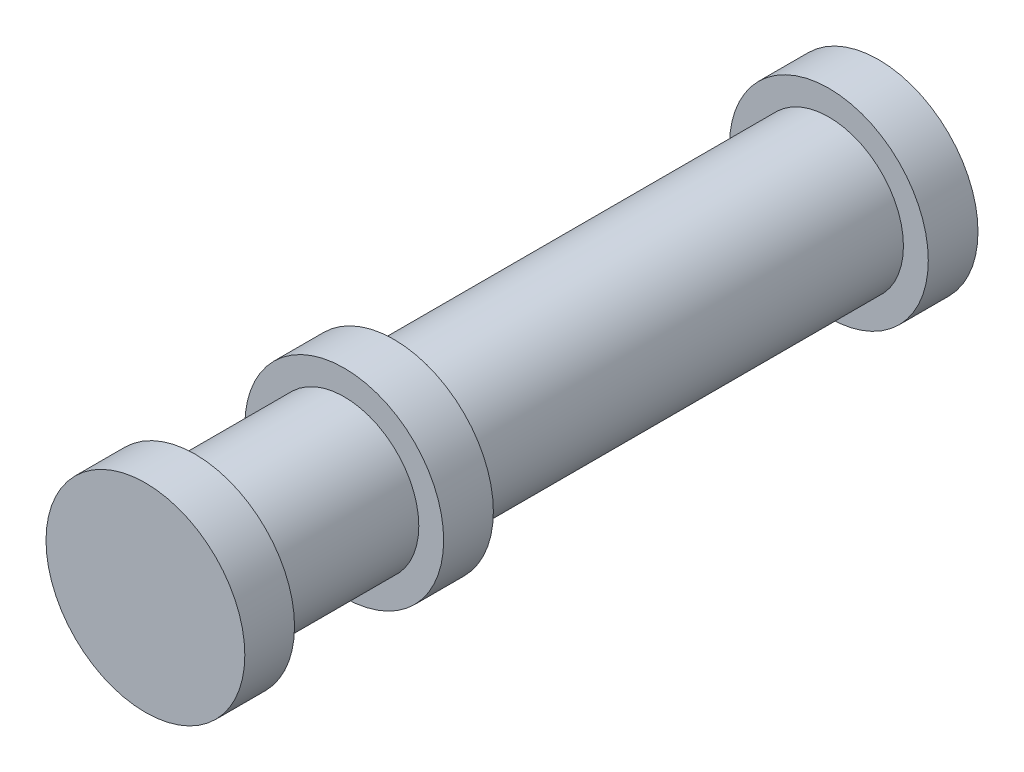
from build123d import *

# Parameters (mm, degrees)
SKETCH_1_R          = 3
EXTRUDE_1_DEPTH     = 17.5
SKETCH_2_R          = 4
EXTRUDE_2_DEPTH     = 2
EXTRUDE_START       = 2
SKETCH_3_R          = 4
EXTRUDE_3_DEPTH     = 2
SKETCH_4_R          = 3
EXTRUDE_4_DEPTH     = 20
SKETCH_5_R          = 4
EXTRUDE_5_DEPTH     = 2
SKETCH_7_R          = 4
CUT_EXTRUDE_1_DEPTH = 16
SKETCH_8_R          = 4
EXTRUDE_6_DEPTH     = 2


with BuildPart() as part:
    # 草图1 → 凸台-拉伸1 (new body)
    with BuildSketch(Plane.XY):
        Circle(SKETCH_1_R)
    extrude(amount=EXTRUDE_1_DEPTH)

    # 草图2 → 凸台-拉伸2 (add)
    with BuildSketch(Plane(origin=(0, 0, 0), x_dir=(-1, 0, 0), z_dir=(0, 0, -1))):
        Circle(SKETCH_2_R)
    extrude(amount=EXTRUDE_2_DEPTH)

    # 草图3 → 凸台-拉伸3 (add)
    with BuildSketch(Plane.XY.offset(17.5).offset(EXTRUDE_START)):
        with Locations(Location((0, 0, 0), (0, 0, 180))):
            Circle(SKETCH_3_R)
    extrude(amount=-EXTRUDE_3_DEPTH)

    # 草图4 → 凸台-拉伸4 (add)
    with BuildSketch(Plane.XY.offset(19.5)):
        Circle(SKETCH_4_R)
    extrude(amount=EXTRUDE_4_DEPTH)

    # 草图5 → 凸台-拉伸5 (add)
    with BuildSketch(Plane.XY.offset(39.5).offset(EXTRUDE_START)):
        with Locations(Location((0, 0, 0), (0, 0, 180))):
            Circle(SKETCH_5_R)
    extrude(amount=-EXTRUDE_5_DEPTH)

    # 草图7 → 切除-拉伸1 (cut)
    with BuildSketch(Plane.XY.offset(41.5)):
        with Locations(Location((0, 0, 0), (0, 0, 180))):
            Circle(SKETCH_7_R)
    extrude(amount=-CUT_EXTRUDE_1_DEPTH, mode=Mode.SUBTRACT)

    # 草图8 → 凸台-拉伸6 (add)
    with BuildSketch(Plane.XY.offset(25.5).offset(EXTRUDE_START)):
        with Locations(Location((0, 0, 0), (0, 0, 180))):
            Circle(SKETCH_8_R)
    extrude(amount=-EXTRUDE_6_DEPTH)


solid = part.part
